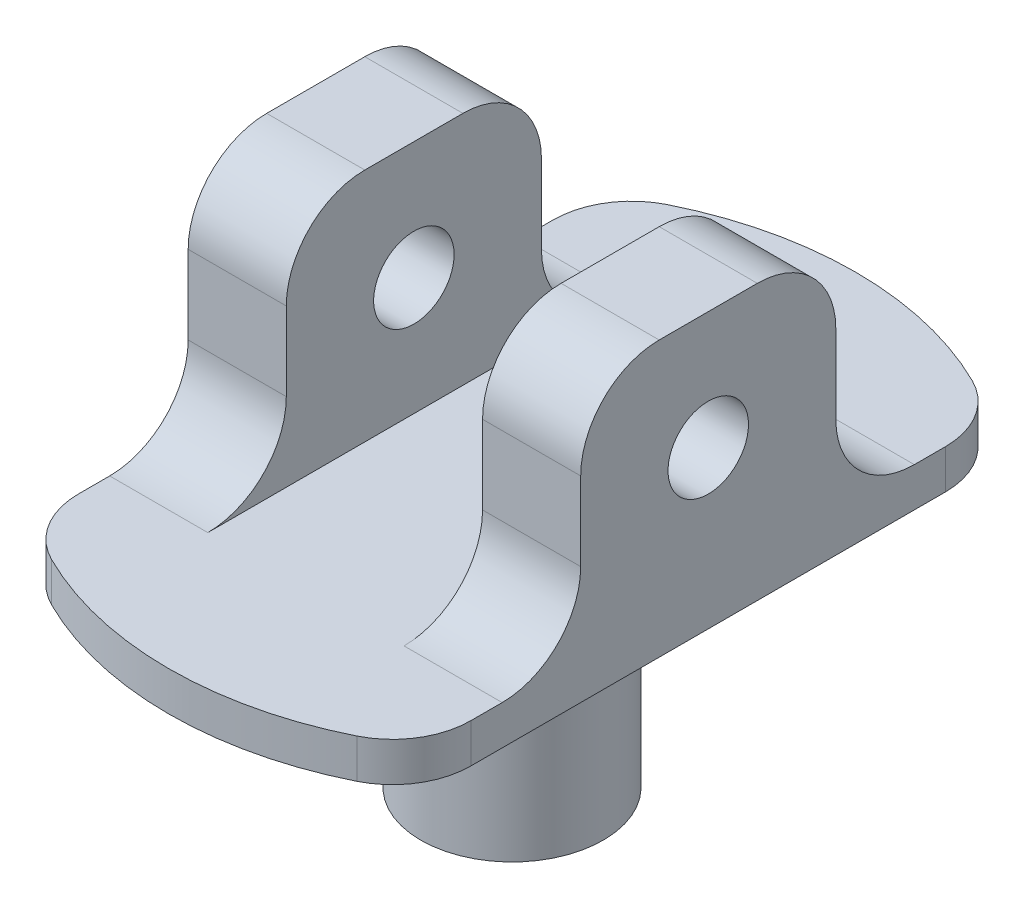
from build123d import *

# Parameters (mm, degrees)
SKETCH1_R           = 4.65
BOSS_EXTRUDE1_DEPTH = 12
SKETCH2_R           = 17.5
BOSS_EXTRUDE2_DEPTH = 2
SKETCH3_W           = 5
SKETCH3_H           = 13
BOSS_EXTRUDE3_DEPTH = 12
FILLET1_R           = 4
FILLET2_R           = 4
CUT_EXTRUDE1_DEPTH  = 29.434134416
SKETCH5_R           = 2.05
CUT_EXTRUDE2_DEPTH  = 70
FILLET3_R           = 4


with BuildPart() as part:
    # Sketch1 → Boss-Extrude1 (new body)
    with BuildSketch(Plane(origin=(0, 0, 0), x_dir=(1, 0, 0), z_dir=(0, 1, 0))):
        with Locations(Location((0, 0, 0), (0, 0, 270))):
            Circle(SKETCH1_R)
    extrude(amount=BOSS_EXTRUDE1_DEPTH)

    # Sketch2 → Boss-Extrude2 (add)
    with BuildSketch(Plane(origin=(0, 12, 0), x_dir=(1, 0, 0), z_dir=(0, 1, 0))):
        with Locations(Location((0, 0, 0), (0, 0, 270))):
            Circle(SKETCH2_R)
    extrude(amount=BOSS_EXTRUDE2_DEPTH)

    # Sketch3 → Boss-Extrude3 (add)
    with BuildSketch(Plane(origin=(0, 14, 0), x_dir=(1, 0, 0), z_dir=(0, 1, 0))):
        with Locations((7.5, 0)):
            Rectangle(SKETCH3_W, SKETCH3_H)
    boss_extrude3 = extrude(amount=BOSS_EXTRUDE3_DEPTH)

    # Mirror1: Boss-Extrude3 across plane
    add(boss_extrude3.mirror(Plane(origin=(0, 0, 0), x_dir=(0, 0, 1), z_dir=(1, 0, 0))))

    # Fillet1
    fillet1_edges = [part.edges().sort_by_distance(p)[0] for p in [
        (7.5, 26, -6.5),
        (7.5, 26, 6.5),
        (-7.5, 26, 6.5),
        (-7.5, 26, -6.5),
    ]]
    fillet(fillet1_edges, radius=FILLET1_R)

    # Fillet2
    fillet2_edges = [part.edges().sort_by_distance(p)[0] for p in [
        (7.5, 14, 6.5),
        (7.5, 14, -6.5),
        (-7.5, 14, -6.5),
        (-7.5, 14, 6.5),
    ]]
    fillet(fillet2_edges, radius=FILLET2_R)

    # Sketch4 → Cut-Extrude1 (cut, through all)
    with BuildSketch(Plane(origin=(0, 14, 0), x_dir=(1, 0, 0), z_dir=(0, 1, 0))):
        with BuildLine():
            Line((10, 14.361406616), (10, 0))
            Line((10, 0), (10, -14.361406616))
            ThreePointArc((10, -14.361406616), (15.512092057, -8.100925873), (17.5, 0))
            ThreePointArc((17.5, 0), (15.512092057, 8.100925873), (10, 14.361406616))
        make_face()
    cut_extrude1 = extrude(amount=-CUT_EXTRUDE1_DEPTH, mode=Mode.SUBTRACT)

    # Mirror2: Cut-Extrude1 across plane
    add(cut_extrude1.mirror(Plane(origin=(0, 0, 0), x_dir=(0, 0, 1), z_dir=(1, 0, 0))), mode=Mode.SUBTRACT)

    # Sketch5 → Cut-Extrude2 (cut)
    with BuildSketch(Plane(origin=(10, 0, 0), x_dir=(0, 0, -1), z_dir=(1, 0, 0))):
        with Locations((0, 20)):
            Circle(SKETCH5_R)
    extrude(amount=-CUT_EXTRUDE2_DEPTH, mode=Mode.SUBTRACT)

    # Fillet3
    fillet3_edges = [part.edges().sort_by_distance(p)[0] for p in [
        (10, 13, -14.361406616),
        (10, 13, 14.361406616),
        (-10, 13, 14.361406616),
        (-10, 13, -14.361406616),
    ]]
    fillet(fillet3_edges, radius=FILLET3_R)


solid = part.part
